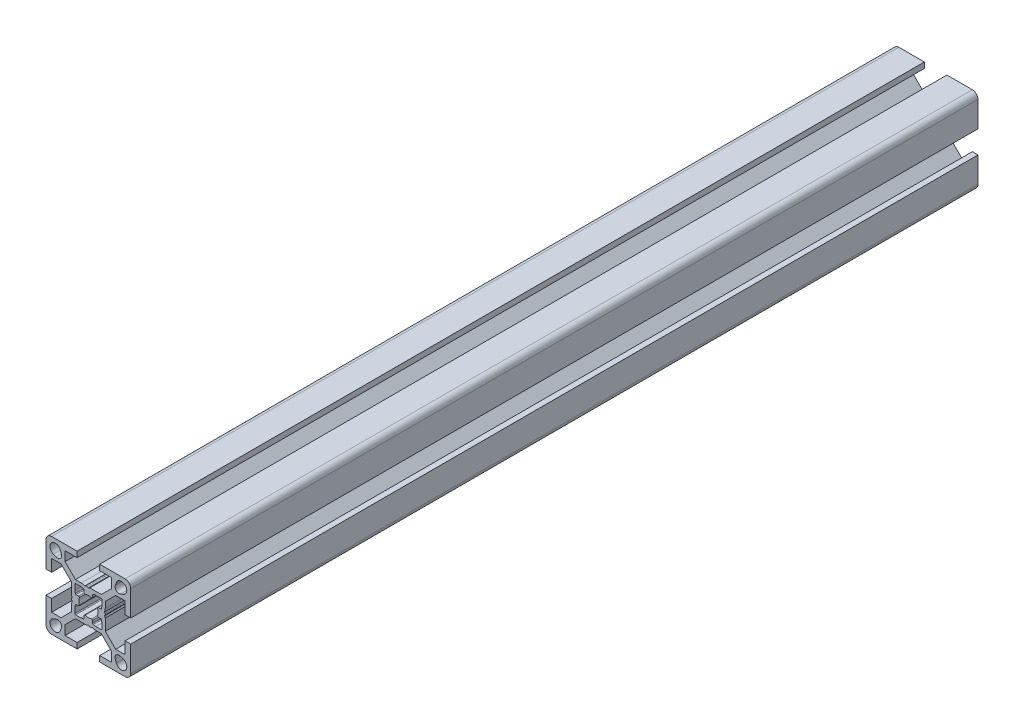
from build123d import *

# Parameters (mm, degrees)
BOSS_EXTRUDE1_DEPTH = 300


with BuildPart() as part:
    # Model → Boss-Extrude1 (new body)
    with BuildSketch(Plane.XY):
        with BuildLine():
            Line((-15, 13), (-15, 4))
            Line((-15, 4), (-13, 4))
            Line((-13, 4), (-13, 8.25))
            Line((-13, 8.25), (-9.664213562, 8.25))
            Line((-9.664213562, 8.25), (-6, 4.585786438))
            Line((-6, 4.585786438), (-6, 0.519615242))
            Line((-6, 0.519615242), (-5.7, 0))
            Line((-5.7, 0), (-5.933012702, -0.403589838))
            ThreePointArc((-5.933012702, -0.403589838), (-6, -0.653589838), (-5.933012702, -0.903589838))
            Line((-5.933012702, -0.903589838), (-5.750976592, -1.218885629))
            Line((-5.750976592, -1.218885629), (-6, -2.5))
            Line((-6, -2.5), (-6, -4.585786438))
            Line((-6, -4.585786438), (-9.664213562, -8.25))
            Line((-9.664213562, -8.25), (-13, -8.25))
            Line((-13, -8.25), (-13, -4))
            Line((-13, -4), (-15, -4))
            Line((-15, -4), (-15, -13))
            ThreePointArc((-15, -13), (-14.414213562, -14.414213562), (-13, -15))
            Line((-13, -15), (-4, -15))
            Line((-4, -15), (-4, -13))
            Line((-4, -13), (-8.25, -13))
            Line((-8.25, -13), (-8.25, -9.664213562))
            Line((-8.25, -9.664213562), (-4.585786438, -6))
            Line((-4.585786438, -6), (-0.519615242, -6))
            Line((-0.519615242, -6), (0, -5.7))
            Line((0, -5.7), (0.403589838, -5.933012702))
            ThreePointArc((0.403589838, -5.933012702), (0.653589838, -6), (0.903589838, -5.933012702))
            Line((0.903589838, -5.933012702), (1.218885629, -5.750976592))
            Line((1.218885629, -5.750976592), (2.5, -6))
            Line((2.5, -6), (4.585786438, -6))
            Line((4.585786438, -6), (8.25, -9.664213562))
            Line((8.25, -9.664213562), (8.25, -13))
            Line((8.25, -13), (4, -13))
            Line((4, -13), (4, -15))
            Line((4, -15), (13, -15))
            ThreePointArc((13, -15), (14.414213562, -14.414213562), (15, -13))
            Line((15, -13), (15, -4))
            Line((15, -4), (13, -4))
            Line((13, -4), (13, -8.25))
            Line((13, -8.25), (9.664213562, -8.25))
            Line((9.664213562, -8.25), (6, -4.585786438))
            Line((6, -4.585786438), (6, -0.519615242))
            Line((6, -0.519615242), (5.7, 0))
            Line((5.7, 0), (5.933012702, 0.403589838))
            ThreePointArc((5.933012702, 0.403589838), (6, 0.653589838), (5.933012702, 0.903589838))
            Line((5.933012702, 0.903589838), (5.750976592, 1.218885629))
            Line((5.750976592, 1.218885629), (6, 2.5))
            Line((6, 2.5), (6, 4.585786438))
            Line((6, 4.585786438), (9.664213562, 8.25))
            Line((9.664213562, 8.25), (13, 8.25))
            Line((13, 8.25), (13, 4))
            Line((13, 4), (15, 4))
            Line((15, 4), (15, 13))
            ThreePointArc((15, 13), (14.414213562, 14.414213562), (13, 15))
            Line((13, 15), (4, 15))
            Line((4, 15), (4, 13))
            Line((4, 13), (8.25, 13))
            Line((8.25, 13), (8.25, 9.664213562))
            Line((8.25, 9.664213562), (4.585786438, 6))
            Line((4.585786438, 6), (0.519615242, 6))
            Line((0.519615242, 6), (0, 5.7))
            Line((0, 5.7), (-0.403589838, 5.933012702))
            ThreePointArc((-0.403589838, 5.933012702), (-0.653589838, 6), (-0.903589838, 5.933012702))
            Line((-0.903589838, 5.933012702), (-1.218885629, 5.750976592))
            Line((-1.218885629, 5.750976592), (-2.5, 6))
            Line((-2.5, 6), (-4.585786438, 6))
            Line((-4.585786438, 6), (-8.25, 9.664213562))
            Line((-8.25, 9.664213562), (-8.25, 13))
            Line((-8.25, 13), (-4, 13))
            Line((-4, 13), (-4, 15))
            Line((-4, 15), (-13, 15))
            ThreePointArc((-13, 15), (-14.414213562, 14.414213562), (-15, 13))
        make_face()
        with BuildLine():
            Line((9.918883282, 12.361530981), (9.539070071, 11.338915743))
            ThreePointArc((9.539070071, 11.338915743), (9.861522369, 9.861522369), (11.338915743, 9.539070071))
            Line((11.338915743, 9.539070071), (12.361530981, 9.918883282))
            ThreePointArc((12.361530981, 9.918883282), (13.043502884, 13.043502884), (9.918883282, 12.361530981))
        make_face(mode=Mode.SUBTRACT)
        with BuildLine():
            Line((12.361530981, -9.918883282), (11.338915743, -9.539070071))
            ThreePointArc((11.338915743, -9.539070071), (9.861522369, -9.861522369), (9.539070071, -11.338915743))
            Line((9.539070071, -11.338915743), (9.918883282, -12.361530981))
            ThreePointArc((9.918883282, -12.361530981), (13.043502884, -13.043502884), (12.361530981, -9.918883282))
        make_face(mode=Mode.SUBTRACT)
        with BuildLine():
            Line((-9.539070071, 11.338915743), (-9.918883282, 12.361530981))
            ThreePointArc((-9.918883282, 12.361530981), (-13.043502884, 13.043502884), (-12.361530981, 9.918883282))
            Line((-12.361530981, 9.918883282), (-11.338915743, 9.539070071))
            ThreePointArc((-11.338915743, 9.539070071), (-9.861522369, 9.861522369), (-9.539070071, 11.338915743))
        make_face(mode=Mode.SUBTRACT)
        with BuildLine():
            Line((-11.338915743, -9.539070071), (-12.361530981, -9.918883282))
            ThreePointArc((-12.361530981, -9.918883282), (-13.043502884, -13.043502884), (-9.918883282, -12.361530981))
            Line((-9.918883282, -12.361530981), (-9.539070071, -11.338915743))
            ThreePointArc((-9.539070071, -11.338915743), (-9.861522369, -9.861522369), (-11.338915743, -9.539070071))
        make_face(mode=Mode.SUBTRACT)
        with BuildLine():
            Line((1.5, 4.335858741), (1.5, 3.5))
            ThreePointArc((1.5, 3.5), (1.374371466, 3.255879964), (1.10270272, 3.21621621))
            ThreePointArc((1.10270272, 3.21621621), (9e-09, 3.4), (-1.102702703, 3.216216216))
            ThreePointArc((-1.102702703, 3.216216216), (-1.374371458, 3.255879959), (-1.5, 3.5))
            Line((-1.5, 3.5), (-1.5, 4.335858741))
            ThreePointArc((-1.5, 4.335858741), (-1.568512625, 4.526682207), (-1.742757301, 4.630346896))
            Line((-1.742757301, 4.630346896), (-2.587190874, 4.794488155))
            ThreePointArc((-2.587190874, 4.794488155), (-2.615679847, 4.79861886), (-2.644433572, 4.8))
            Line((-2.644433572, 4.8), (-4.5, 4.8))
            ThreePointArc((-4.5, 4.8), (-4.712132034, 4.712132034), (-4.8, 4.5))
            Line((-4.8, 4.5), (-4.8, 2.644433572))
            ThreePointArc((-4.8, 2.644433572), (-4.79861886, 2.615679847), (-4.794488155, 2.587190874))
            Line((-4.794488155, 2.587190874), (-4.630346896, 1.742757301))
            ThreePointArc((-4.630346896, 1.742757301), (-4.526682207, 1.568512625), (-4.335858741, 1.5))
            Line((-4.335858741, 1.5), (-3.5, 1.5))
            ThreePointArc((-3.5, 1.5), (-3.255879964, 1.374371466), (-3.21621621, 1.10270272))
            ThreePointArc((-3.21621621, 1.10270272), (-3.4, 9e-09), (-3.216216216, -1.102702703))
            ThreePointArc((-3.216216216, -1.102702703), (-3.255879959, -1.374371458), (-3.5, -1.5))
            Line((-3.5, -1.5), (-4.335858741, -1.5))
            ThreePointArc((-4.335858741, -1.5), (-4.526682207, -1.568512625), (-4.630346896, -1.742757301))
            Line((-4.630346896, -1.742757301), (-4.794488155, -2.587190874))
            ThreePointArc((-4.794488155, -2.587190874), (-4.798618859, -2.615679844), (-4.8, -2.644433568))
            Line((-4.8, -2.644433568), (-4.8, -4.5))
            ThreePointArc((-4.8, -4.5), (-4.712132034, -4.712132034), (-4.5, -4.8))
            Line((-4.5, -4.8), (-2.644433572, -4.8))
            ThreePointArc((-2.644433572, -4.8), (-2.615679847, -4.79861886), (-2.587190874, -4.794488155))
            Line((-2.587190874, -4.794488155), (-1.742757301, -4.630346896))
            ThreePointArc((-1.742757301, -4.630346896), (-1.568512625, -4.526682207), (-1.5, -4.335858741))
            Line((-1.5, -4.335858741), (-1.5, -3.5))
            ThreePointArc((-1.5, -3.5), (-1.374371466, -3.255879964), (-1.10270272, -3.21621621))
            ThreePointArc((-1.10270272, -3.21621621), (-9e-09, -3.4), (1.102702703, -3.216216216))
            ThreePointArc((1.102702703, -3.216216216), (1.374371458, -3.255879959), (1.5, -3.5))
            Line((1.5, -3.5), (1.5, -4.335858741))
            ThreePointArc((1.5, -4.335858741), (1.568512625, -4.526682207), (1.742757301, -4.630346896))
            Line((1.742757301, -4.630346896), (2.587190874, -4.794488155))
            ThreePointArc((2.587190874, -4.794488155), (2.615679847, -4.79861886), (2.644433572, -4.8))
            Line((2.644433572, -4.8), (4.5, -4.8))
            ThreePointArc((4.5, -4.8), (4.712132034, -4.712132034), (4.8, -4.5))
            Line((4.8, -4.5), (4.8, -2.644433572))
            ThreePointArc((4.8, -2.644433572), (4.79861886, -2.615679847), (4.794488155, -2.587190874))
            Line((4.794488155, -2.587190874), (4.630346896, -1.742757301))
            ThreePointArc((4.630346896, -1.742757301), (4.526682207, -1.568512625), (4.335858741, -1.5))
            Line((4.335858741, -1.5), (3.5, -1.5))
            ThreePointArc((3.5, -1.5), (3.255879964, -1.374371466), (3.21621621, -1.10270272))
            ThreePointArc((3.21621621, -1.10270272), (3.4, -9e-09), (3.216216216, 1.102702703))
            ThreePointArc((3.216216216, 1.102702703), (3.255879959, 1.374371458), (3.5, 1.5))
            Line((3.5, 1.5), (4.335858741, 1.5))
            ThreePointArc((4.335858741, 1.5), (4.526682207, 1.568512625), (4.630346896, 1.742757301))
            Line((4.630346896, 1.742757301), (4.794488155, 2.587190874))
            ThreePointArc((4.794488155, 2.587190874), (4.79861886, 2.615679849), (4.8, 2.644433577))
            Line((4.8, 2.644433577), (4.8, 4.5))
            ThreePointArc((4.8, 4.5), (4.712132034, 4.712132034), (4.5, 4.8))
            Line((4.5, 4.8), (2.644433572, 4.8))
            ThreePointArc((2.644433572, 4.8), (2.615679847, 4.79861886), (2.587190874, 4.794488155))
            Line((2.587190874, 4.794488155), (1.742757301, 4.630346896))
            ThreePointArc((1.742757301, 4.630346896), (1.568512625, 4.526682207), (1.5, 4.335858741))
        make_face(mode=Mode.SUBTRACT)
    extrude(amount=BOSS_EXTRUDE1_DEPTH)


solid = part.part
